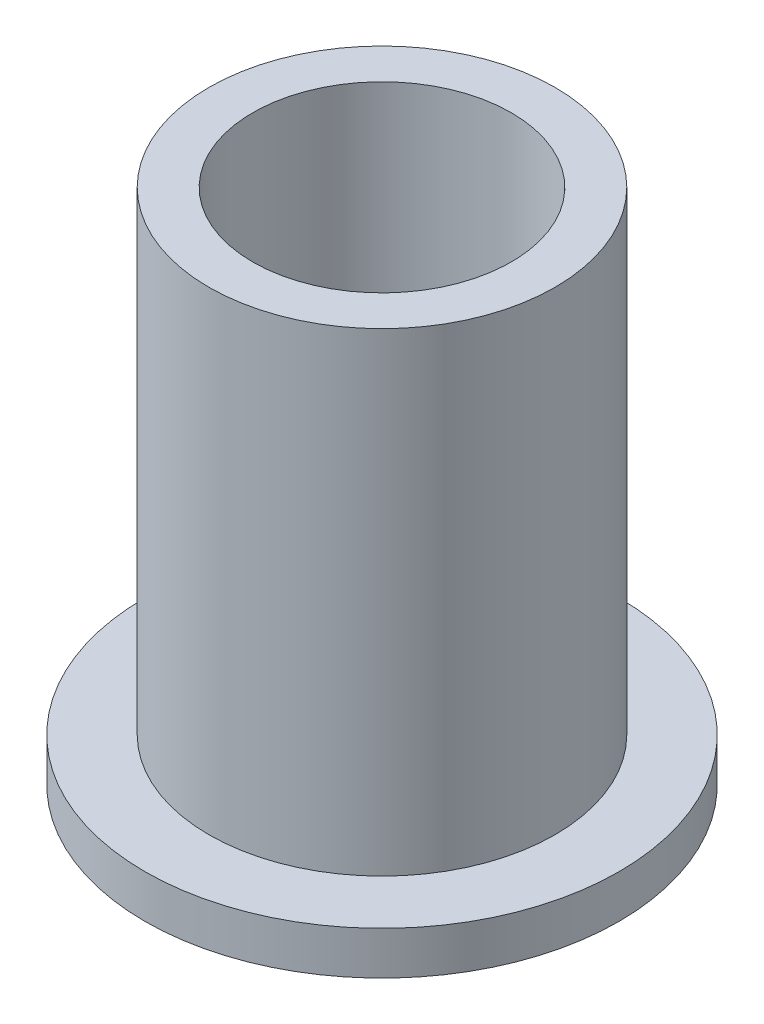
from build123d import *

# Parameters (mm, degrees)
SKETCH2_R           = 6.3754
SKETCH2_R_2         = 4.7625
BOSS_EXTRUDE1_DEPTH = 19.05
SKETCH3_R           = 8.73125
SKETCH3_R_2         = 6.3754
BOSS_EXTRUDE2_DEPTH = 1.5875


with BuildPart() as part:
    # Sketch2 → Boss-Extrude1 (new body)
    with BuildSketch(Plane(origin=(0, 0, 0), x_dir=(1, 0, 0), z_dir=(0, 1, 0))):
        with Locations(Location((0, 0, 0), (0, 0, 90))):
            Circle(SKETCH2_R)
        with Locations(Location((0, 0, 0), (0, 0, 90))):
            Circle(SKETCH2_R_2, mode=Mode.SUBTRACT)
    extrude(amount=BOSS_EXTRUDE1_DEPTH)

    # Sketch3 → Boss-Extrude2 (add)
    with BuildSketch(Plane(origin=(0, 0, 0), x_dir=(1, 0, 0), z_dir=(0, 1, 0))):
        with Locations(Location((0, 0, 0), (0, 0, 270))):
            Circle(SKETCH3_R)
        with Locations(Location((0, 0, 0), (0, 0, 90))):
            Circle(SKETCH3_R_2, mode=Mode.SUBTRACT)
    extrude(amount=BOSS_EXTRUDE2_DEPTH)


solid = part.part
